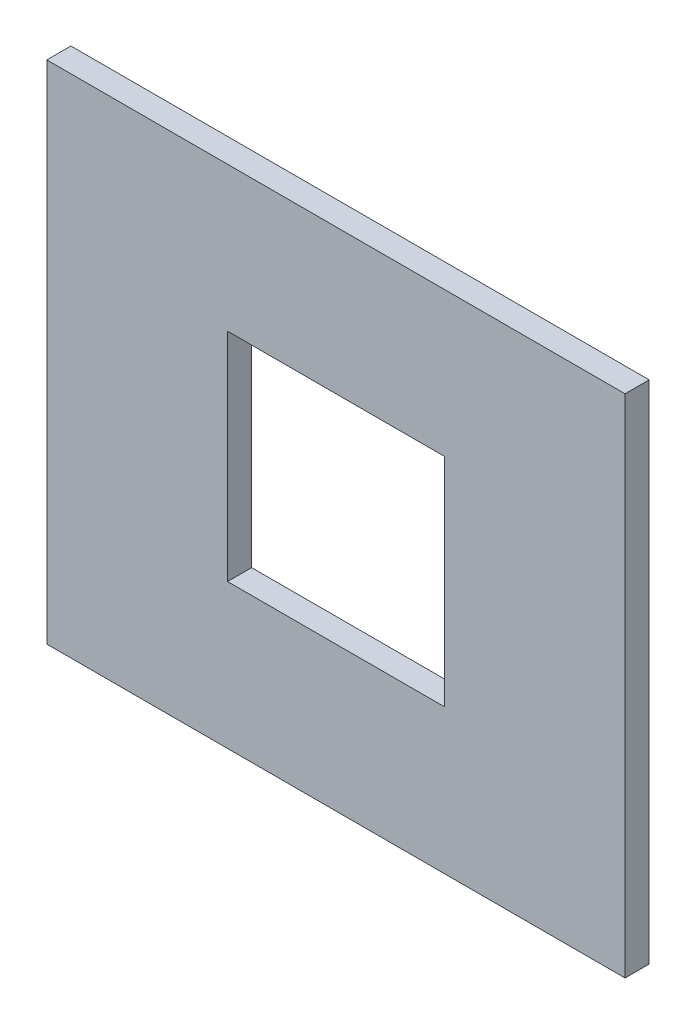
from build123d import *

# Parameters (mm, degrees)
SKETCH1_W      = 304.8
SKETCH1_H      = 266.7
SKETCH1_W_2    = 114.3
SKETCH1_H_2    = 114.3
EXTRUDE1_DEPTH = 12.7


with BuildPart() as part:
    # Sketch1 → Extrude1 (new body)
    with BuildSketch(Plane.XY):
        Rectangle(SKETCH1_W, SKETCH1_H)
        Rectangle(SKETCH1_W_2, SKETCH1_H_2, mode=Mode.SUBTRACT)
    extrude(amount=EXTRUDE1_DEPTH)


solid = part.part
